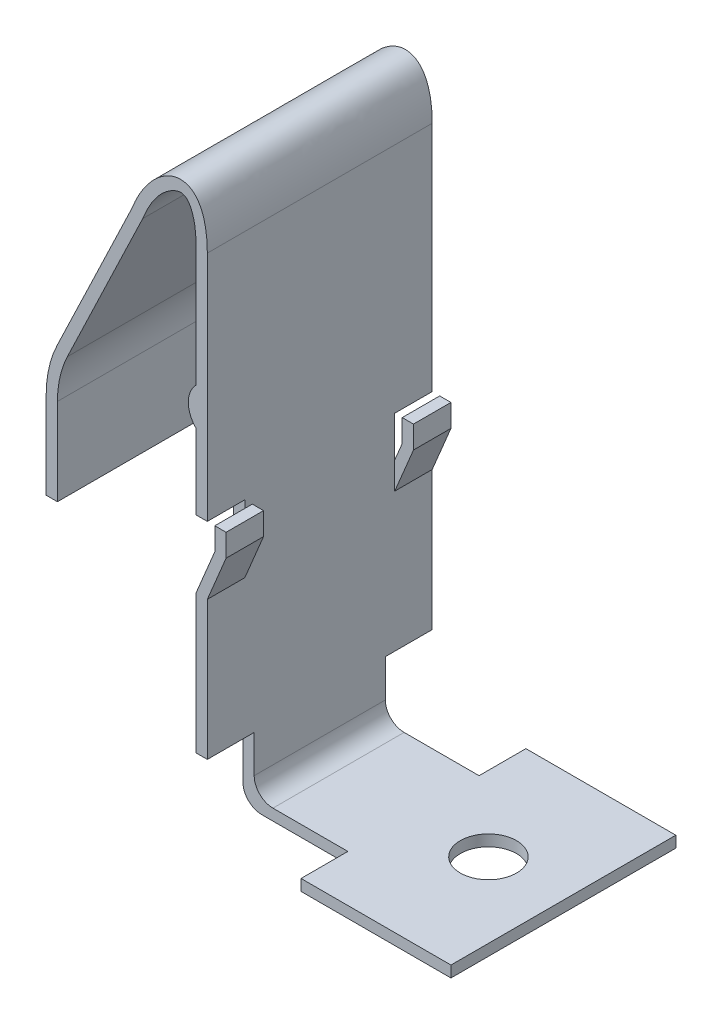
from build123d import *

# Parameters (mm, degrees)
BOSS_EXTRUDE1_DEPTH      = 0.3
BOSS_EXTRUDE2_DEPTH      = 3
BOSS_EXTRUDE2_DEPTH_BACK = 3
BOSS_EXTRUDE2_START      = -1.75
SKETCH2_W                = 0.3
SKETCH2_H                = 13.5
BOSS_EXTRUDE3_DEPTH      = 3
BOSS_EXTRUDE3_DEPTH_BACK = 3
BOSS_EXTRUDE3_START      = -1.75
CUT_EXTRUDE1_REACH       = 19.264
SKETCH4_R                = 0.75
CUT_EXTRUDE2_REACH       = 18.483
SKETCH7_W                = 0.3
SKETCH7_H                = 1.8
CUT_EXTRUDE3_DEPTH       = 1
BOSS_EXTRUDE4_DEPTH      = 1
BOSS_EXTRUDE5_DEPTH      = 1
FILLET1_R                = 0.5


with BuildPart() as part:
    # Sketch1 → Boss-Extrude1 (new body)
    with BuildSketch(Plane(origin=(0, 0, 0), x_dir=(1, 0, 0), z_dir=(0, 1, 0))):
        Polygon((-2, 3), (2, 3), (2, -3), (-2, -3), (-2, -1.75), (-4.5, -1.75), (-4.5, 1.75), (-2, 1.75), align=None)
    extrude(amount=BOSS_EXTRUDE1_DEPTH)

    # Sketch2 → Boss-Extrude2 (add, two sides: drawn at the far end of the back side and taken through both)
    with BuildSketch(Plane.XY.offset(1.75).offset(BOSS_EXTRUDE2_START - BOSS_EXTRUDE2_DEPTH_BACK)):
        with Locations((-4.65, 6.75)):
            Rectangle(SKETCH2_W, SKETCH2_H)
    extrude(amount=BOSS_EXTRUDE2_DEPTH + BOSS_EXTRUDE2_DEPTH_BACK)

    # Sketch3 → Boss-Extrude3 (add, two sides: drawn at the far end of the back side and taken through both)
    with BuildSketch(Plane.XY.offset(1.75).offset(BOSS_EXTRUDE3_START - BOSS_EXTRUDE3_DEPTH_BACK)):
        with BuildLine():
            Line((-6.5, 13.554573958), (-8.505448086, 9.369290995))
            ThreePointArc((-8.505448086, 9.369290995), (-8.725435374, 8.737631794), (-8.8, 8.072930454))
            Line((-8.8, 8.072930454), (-8.8, 5.754573958))
            Line((-8.8, 5.754573958), (-8.5, 5.754573958))
            Line((-8.5, 5.754573958), (-8.5, 8.072930454))
            ThreePointArc((-8.5, 8.072930454), (-8.432891837, 8.67116166), (-8.234903278, 9.239654941))
            Line((-8.234903278, 9.239654941), (-6.224158485, 13.435991899))
            add(Edge.make_bspline(
                [(-4.8, 13.499999998), (-4.800000001, 13.60647764), (-4.810501359, 13.834290272), (-4.865595968, 14.168326182), (-4.985627931, 14.441197759), (-5.11401111, 14.537231122), (-5.274676327, 14.571482274), (-5.645213861, 14.387952807), (-6.003576613, 13.924542153), (-6.162685709, 13.596781364), (-6.224158485, 13.435991899)],
                knots=[0, 0, 0, 0, 0.062658964, 0.125317927, 0.250635855, 0.375953782, 0.50127171, 0.751907565, 0.877225492, 1.00254342, 1.00254342, 1.00254342, 1.00254342], degree=3))
            Line((-4.8, 13.499999998), (-4.5, 13.5))
            add(Edge.make_bspline(
                [(-4.5, 13.5), (-4.500000011, 15.507992756), (-5.926328545, 15.055080891), (-6.5, 13.554573958)],
                knots=[0, 0, 0, 0, 1, 1, 1, 1], degree=3))
        make_face()
    extrude(amount=BOSS_EXTRUDE3_DEPTH + BOSS_EXTRUDE3_DEPTH_BACK)

    # Sketch4 → Cut-Extrude1 (cut, up to next)
    with BuildSketch(Plane(origin=(0, 0.3, 0), x_dir=(1, 0, 0), z_dir=(0, 1, 0)), mode=Mode.PRIVATE) as cut_extrude1_sk1:
        with Locations(Location((0, 0, 0), (0, 0, 270))):
            Circle(SKETCH4_R)
    cut_extrude1_tool1 = extrude(cut_extrude1_sk1.sketch, amount=-CUT_EXTRUDE1_REACH, mode=Mode.PRIVATE) & part.part
    add(cut_extrude1_tool1.solids().sort_by_distance((0, 0.3, 0))[0], mode=Mode.SUBTRACT)

    # Sketch6 → Cut-Extrude2 (cut, up to next)
    with BuildSketch(Plane(origin=(-4.5, 0, 0), x_dir=(0, 0, -1), z_dir=(1, 0, 0)), mode=Mode.PRIVATE) as cut_extrude2_sk1:
        Polygon((1.75, 1.8), (1.75, 0.3), (1.75, 0), (3, 0), (3, 1.8), align=None)
    cut_extrude2_tool1 = extrude(cut_extrude2_sk1.sketch, amount=-CUT_EXTRUDE2_REACH, mode=Mode.PRIVATE) & part.part
    # Sketch6 → Cut-Extrude2 (cut, up to next)
    with BuildSketch(Plane(origin=(-4.5, 0, 0), x_dir=(0, 0, -1), z_dir=(1, 0, 0)), mode=Mode.PRIVATE) as cut_extrude2_sk2:
        Polygon((-1.75, 0.3), (-1.75, 1.8), (-3, 1.8), (-3, 0), (-1.75, 0), align=None)
    cut_extrude2_tool2 = extrude(cut_extrude2_sk2.sketch, amount=-CUT_EXTRUDE2_REACH, mode=Mode.PRIVATE) & part.part
    add(cut_extrude2_tool1.solids().sort_by_distance((-4.5, 0.9, -2.375))[0], mode=Mode.SUBTRACT)
    add(cut_extrude2_tool2.solids().sort_by_distance((-4.5, 0.9, 2.375))[0], mode=Mode.SUBTRACT)

    # Sketch7 → Cut-Extrude3 (cut)
    with BuildSketch(Plane.XY.offset(3)):
        with Locations((-4.65, 6.4)):
            Rectangle(SKETCH7_W, SKETCH7_H)
    cut_extrude3 = extrude(amount=-CUT_EXTRUDE3_DEPTH, mode=Mode.SUBTRACT)

    # Mirror1: Cut-Extrude3 across plane
    add(cut_extrude3.mirror(Plane.XY), mode=Mode.SUBTRACT)

    # Sketch8 → Boss-Extrude4 (add)
    with BuildSketch(Plane.XY.offset(3)):
        Polygon((-4.5, 5.5), (-4, 6.7), (-4, 7.3), (-4.3, 7.3), (-4.3, 6.7), (-4.8, 5.5), align=None)
    boss_extrude4 = extrude(amount=-BOSS_EXTRUDE4_DEPTH)

    # Mirror2: Boss-Extrude4 across plane
    add(boss_extrude4.mirror(Plane.XY))

    # Sketch9 → Boss-Extrude5 (add)
    with BuildSketch(Plane.XY.offset(3)):
        with BuildLine():
            Line((-4.8, 9.3), (-4.8, 10.3))
            ThreePointArc((-4.8, 10.3), (-5.007106781, 9.8), (-4.8, 9.3))
        make_face()
    boss_extrude5 = extrude(amount=-BOSS_EXTRUDE5_DEPTH)

    # Mirror4: Boss-Extrude5 across plane
    add(boss_extrude5.mirror(Plane.XY))

    # Fillet1
    fillet1_edges = [part.edges().sort_by_distance(p)[0] for p in [
        (-4.5, 0.3, 0),
        (-4.8, 0, 0),
    ]]
    fillet(fillet1_edges, radius=FILLET1_R)


solid = part.part
